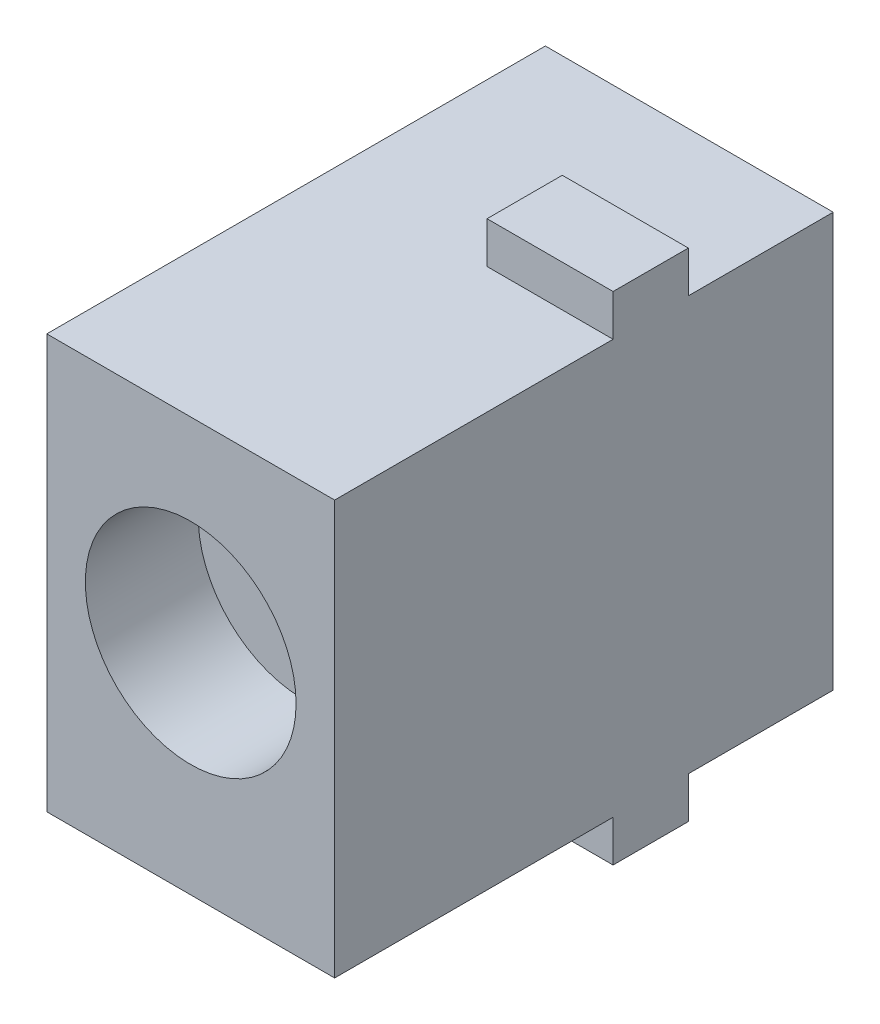
from build123d import *

# Parameters (mm, degrees)
SKETCH_1_W          = 7.65
SKETCH_1_H          = 11
EXTRUDE_1_DEPTH     = 13.25
SKETCH_2_W          = 3.35
SKETCH_2_H          = 2
EXTRUDE_2_DEPTH     = 1.1
SKETCH_3_R          = 2.8
CUT_EXTRUDE_1_DEPTH = 3


with BuildPart() as part:
    # Эскиз1 → Бобышка-Вытянуть1 (new body)
    with BuildSketch(Plane.XY):
        Rectangle(SKETCH_1_W, SKETCH_1_H)
    extrude(amount=EXTRUDE_1_DEPTH)

    # Эскиз2 → Бобышка-Вытянуть2 (add)
    with BuildSketch(Plane(origin=(0, 5.5, 0), x_dir=(1, 0, 0), z_dir=(0, 1, 0))):
        with Locations((2.15, -4.85)):
            Rectangle(SKETCH_2_W, SKETCH_2_H)
    extrude_2 = extrude(amount=EXTRUDE_2_DEPTH)

    # Зеркальное отражение1: Бобышка-Вытянуть2 across plane
    add(extrude_2.mirror(Plane.ZX))

    # Эскиз3 → Вырез-Вытянуть1 (cut)
    with BuildSketch(Plane.XY.offset(13.25)):
        with Locations((0, 0.3)):
            Circle(SKETCH_3_R)
    extrude(amount=-CUT_EXTRUDE_1_DEPTH, mode=Mode.SUBTRACT)


solid = part.part
